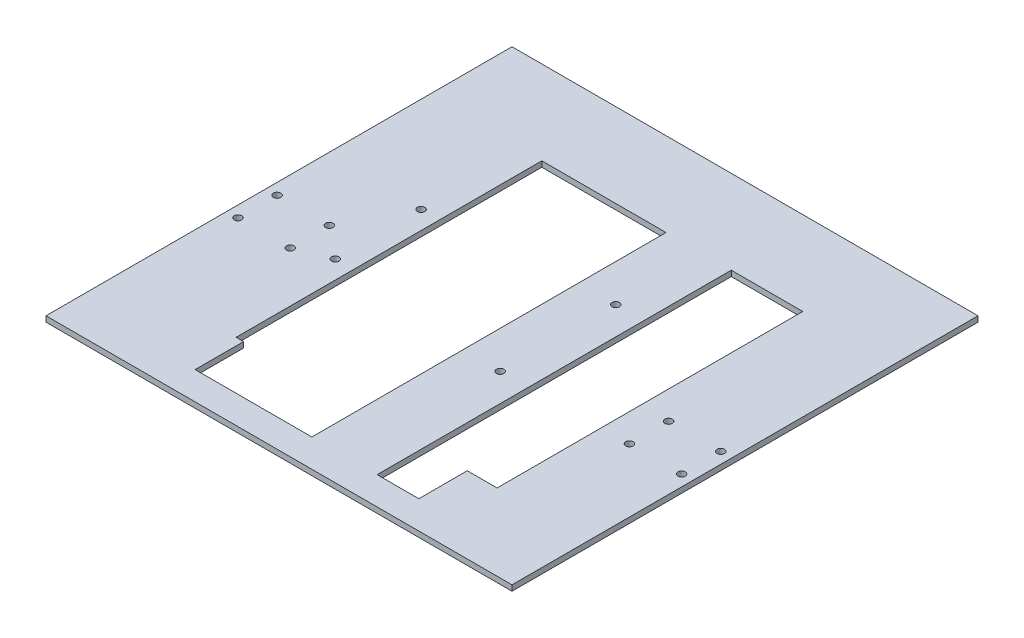
from build123d import *

# Parameters (mm, degrees)
SKETCH1_W           = 250
SKETCH1_H           = 250
BOSS_EXTRUDE1_DEPTH = 3
SKETCH4_R           = 2
CUT_EXTRUDE1_DEPTH  = 3
CUT_EXTRUDE2_DEPTH  = 3


with BuildPart() as part:
    # Sketch1 → Boss-Extrude1 (new body)
    with BuildSketch(Plane(origin=(0, 0, 0), x_dir=(1, 0, 0), z_dir=(0, 1, 0))):
        Rectangle(SKETCH1_W, SKETCH1_H)
    extrude(amount=BOSS_EXTRUDE1_DEPTH)

    # Sketch4 → Cut-Extrude1 (cut)
    with BuildSketch(Plane(origin=(0, 3, 0), x_dir=(1, 0, 0), z_dir=(0, 1, 0))):
        with Locations(Location((91, -28, 0), (0, 0, 270))):
            Circle(SKETCH4_R)
        with Locations(Location((91, -7, 0), (0, 0, 270))):
            Circle(SKETCH4_R)
        with Locations(Location((119, -7, 0), (0, 0, 270))):
            Circle(SKETCH4_R)
        with Locations(Location((119, -28, 0), (0, 0, 270))):
            Circle(SKETCH4_R)
        with Locations(Location((22.62859709, -29, 0), (0, 0, 270))):
            Circle(SKETCH4_R)
        with Locations(Location((22.62859709, 33, 0), (0, 0, 270))):
            Circle(SKETCH4_R)
        with Locations(Location((-73.776388534, 25, 0), (0, 0, 270))):
            Circle(SKETCH4_R)
        with Locations(Location((-73.776388534, -21, 0), (0, 0, 270))):
            Circle(SKETCH4_R)
        with Locations(Location((-91, -28, 0), (0, 0, 270))):
            Circle(SKETCH4_R)
        with Locations(Location((-91, -7, 0), (0, 0, 270))):
            Circle(SKETCH4_R)
        with Locations(Location((-119, -7, 0), (0, 0, 270))):
            Circle(SKETCH4_R)
        with Locations(Location((-119, -28, 0), (0, 0, 270))):
            Circle(SKETCH4_R)
    extrude(amount=-CUT_EXTRUDE1_DEPTH, mode=Mode.SUBTRACT)

    # Sketch5 → Cut-Extrude2 (cut)
    with BuildSketch(Plane(origin=(0, 3, 0), x_dir=(1, 0, 0), z_dir=(0, 1, 0))):
        Polygon((2.62859709, -110), (-60, -110), (-60, -84), (-64, -84), (-64, 80), (2.62859709, 80), align=None)
        Polygon((37.62859709, 80), (37.62859709, -110), (60, -110), (60, -84), (76, -84), (76, 80), align=None)
    extrude(amount=-CUT_EXTRUDE2_DEPTH, mode=Mode.SUBTRACT)


solid = part.part
